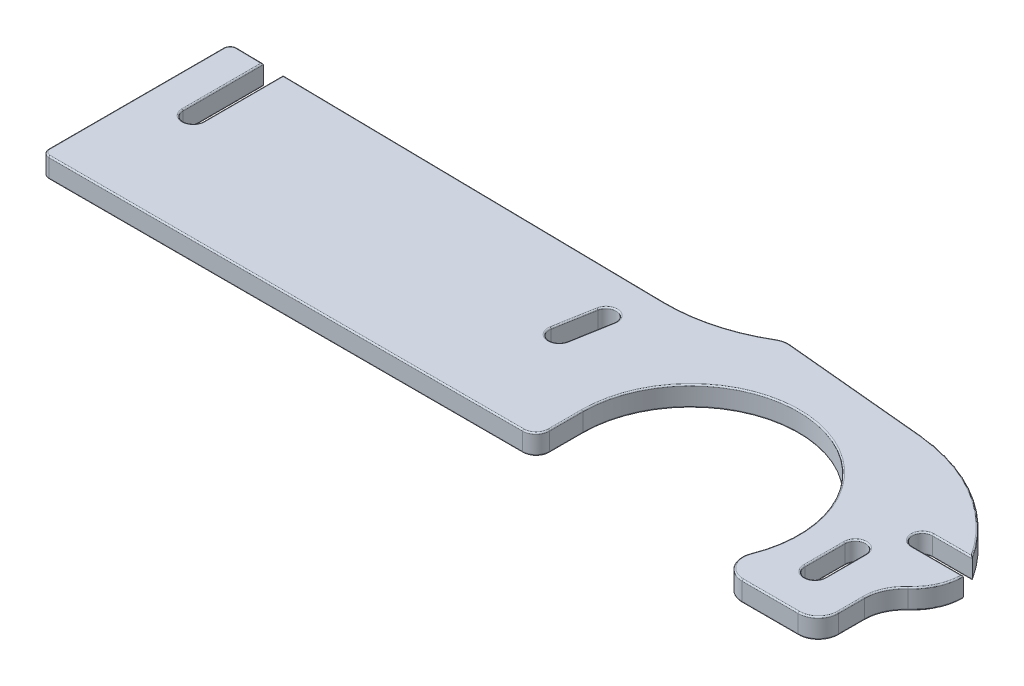
from build123d import *

# Parameters (mm, degrees)
BOSS_EXTRUDE1_DEPTH = 3
FILLET1_R           = 0.2


with BuildPart() as part:
    # Sketch1 → Boss-Extrude1 (new body)
    with BuildSketch(Plane(origin=(0, 0, 0), x_dir=(1, 0, 0), z_dir=(0, 1, 0))):
        with BuildLine():
            Line((-24, 20), (-81.5, 20.877862595))
            Line((-81.5, 20.877862595), (-81.5, 9))
            ThreePointArc((-81.5, 9), (-83, 7.5), (-84.5, 9))
            Line((-84.5, 9), (-84.5, 20.923664122))
            Line((-84.5, 20.923664122), (-88.484734603, 20.984499765))
            ThreePointArc((-88.484734603, 20.984499765), (-89.201688892, 20.69709976), (-89.5, 19.984616288))
            Line((-89.5, 19.984616288), (-89.5, -6))
            ThreePointArc((-89.5, -6), (-89.207106781, -6.707106781), (-88.5, -7))
            Line((-88.5, -7), (-18, -7))
            ThreePointArc((-18, -7), (-16.585786438, -6.414213562), (-16, -5))
            Line((-16, -5), (-16, 0))
            ThreePointArc((-16, 0), (3.000607116, 15.716117744), (14.874544617, -5.894736842))
            ThreePointArc((14.874544617, -5.894736842), (15.182011157, -8.685854461), (17.663521733, -10))
            Line((17.663521733, -10), (26, -10))
            ThreePointArc((26, -10), (28.121320344, -9.121320344), (29, -7))
            Line((29, -7), (29, -3.140573969))
            ThreePointArc((29, -3.140573969), (29.52749792, -0.680549379), (31.017240328, 1.346922593))
            ThreePointArc((31.017240328, 1.346922593), (32.893927927, 3.901009452), (33.558437979, 7))
            Line((33.558437979, 7), (26, 7))
            ThreePointArc((26, 7), (24.5, 8.5), (26, 10))
            Line((26, 10), (31.9089023, 10))
            ThreePointArc((31.9089023, 10), (23.544889663, 18.193151286), (12.434141003, 21.885806103))
            Line((12.434141003, 21.885806103), (-9.046269836, 23.905690999))
            ThreePointArc((-9.046269836, 23.905690999), (-9.984592082, 23.84593855), (-10.858335776, 23.498676472))
            ThreePointArc((-10.858335776, 23.498676472), (-17.186697633, 20.838575925), (-24, 20))
        make_face()
        with BuildLine():
            Line((23.5, 2.5), (23.5, -3.5))
            ThreePointArc((23.5, -3.5), (22, -5), (20.5, -3.5))
            Line((20.5, -3.5), (20.5, 2.5))
            ThreePointArc((20.5, 2.5), (22, 4), (23.5, 2.5))
        make_face(mode=Mode.SUBTRACT)
        with BuildLine():
            Line((-25.02278837, 13.648374252), (-26.064677436, 7.739527733))
            ThreePointArc((-26.064677436, 7.739527733), (-27.802361333, 6.52278837), (-29.019100696, 8.260472267))
            Line((-29.019100696, 8.260472267), (-27.97721163, 14.169318785))
            ThreePointArc((-27.97721163, 14.169318785), (-26.239527733, 15.386058148), (-25.02278837, 13.648374252))
        make_face(mode=Mode.SUBTRACT)
    extrude(amount=BOSS_EXTRUDE1_DEPTH)

    # Fillet1
    fillet1_edges = [part.edges().sort_by_distance(p)[0] for p in [
        (21.831760866, 3, 10),
        (28.121320344, 3, 9.121320344),
        (29, 3, 5.070286985),
        (29.52749792, 3, 0.680549379),
        (-16, 0, 2.5),
        (-16.585786438, 0, 6.414213562),
        (32.893927927, 3, -3.901009452),
        (-53.25, 0, 7),
        (-89.207106781, 0, 6.707106781),
        (-89.5, 0, -6.992308144),
        (-89.201688892, 0, -20.69709976),
        (-86.492367302, 0, -20.954081944),
        (-84.5, 0, -14.961832061),
        (-83, 0, -7.5),
        (-81.5, 0, -14.938931298),
        (29.779218989, 3, -7),
        (-52.75, 0, -20.438931298),
        (-17.186697633, 0, -20.838575925),
        (-9.984592082, 0, -23.84593855),
        (1.693935584, 0, -22.895748551),
        (23.544889663, 0, -18.193151286),
        (28.95445115, 0, -10),
        (24.5, 0, -8.5),
        (24.5, 3, -8.5),
        (29.779218989, 0, -7),
        (32.893927927, 0, -3.901009452),
        (29.52749792, 0, 0.680549379),
        (29, 0, 5.070286985),
        (28.121320344, 0, 9.121320344),
        (21.831760866, 0, 10),
        (15.182011157, 0, 8.685854461),
        (3.000607116, 0, -15.716117744),
        (28.95445115, 3, -10),
        (23.544889663, 3, -18.193151286),
        (1.693935584, 3, -22.895748551),
        (3.000607116, 3, -15.716117744),
        (-9.984592082, 3, -23.84593855),
        (-17.186697633, 3, -20.838575925),
        (-52.75, 3, -20.438931298),
        (-81.5, 3, -14.938931298),
        (-83, 3, -7.5),
        (-84.5, 3, -14.961832061),
        (-86.492367302, 3, -20.954081944),
        (-89.201688892, 3, -20.69709976),
        (22, 0, -4),
        (20.5, 0, 0.5),
        (22, 0, 5),
        (23.5, 0, 0.5),
        (22, 3, -4),
        (20.5, 3, 0.5),
        (22, 3, 5),
        (23.5, 3, 0.5),
        (-89.5, 3, -6.992308144),
        (-89.207106781, 3, 6.707106781),
        (15.182011157, 3, 8.685854461),
        (-53.25, 3, 7),
        (-16.585786438, 3, 6.414213562),
        (-26.239527733, 0, -15.386058148),
        (-28.498156163, 0, -11.214895526),
        (-27.802361333, 0, -6.52278837),
        (-25.543732903, 0, -10.693950993),
        (-26.239527733, 3, -15.386058148),
        (-28.498156163, 3, -11.214895526),
        (-16, 3, 2.5),
        (-27.802361333, 3, -6.52278837),
        (-25.543732903, 3, -10.693950993),
    ]]
    fillet(fillet1_edges, radius=FILLET1_R)


solid = part.part
